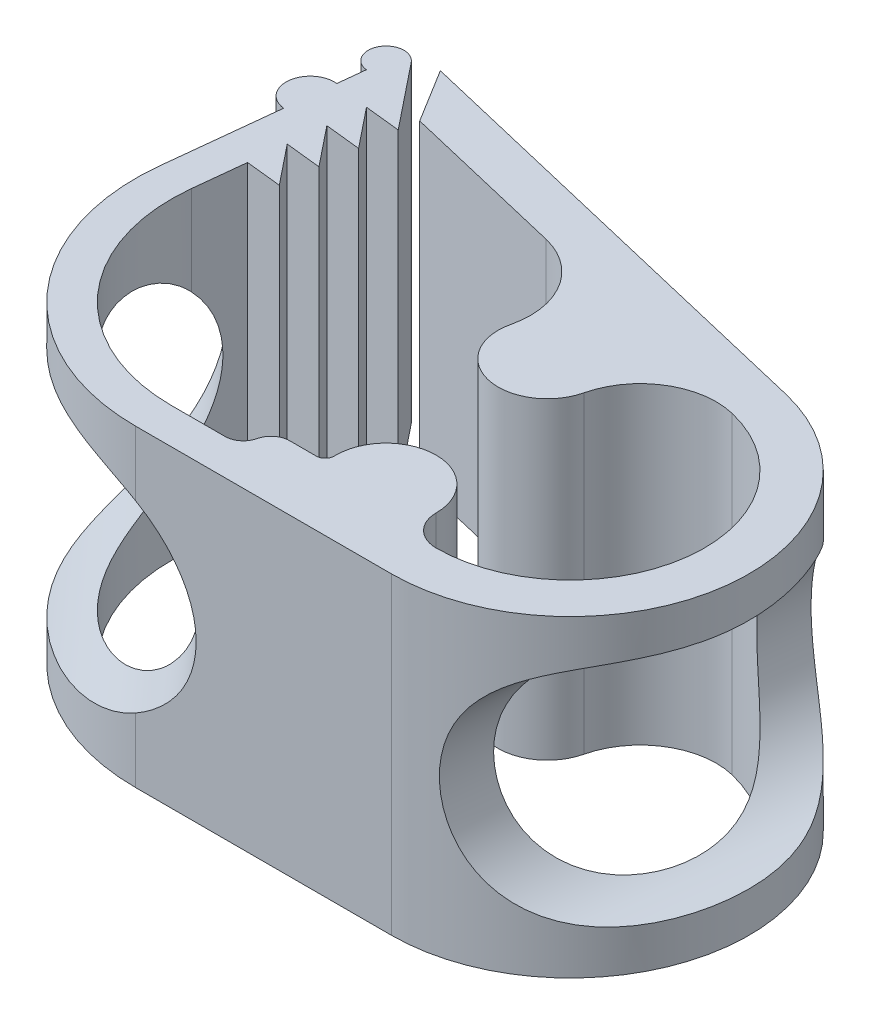
from build123d import *

# Parameters (mm, degrees)
BOSS_EXTRUDE3_DEPTH     = 8.75
CUT_EXTRUDE1_DEPTH      = 30.433335283
CUT_EXTRUDE1_DEPTH_BACK = 30.433335283
SKETCH2_R               = 6.5
CUT_EXTRUDE2_DEPTH      = 30.248560932
CUT_EXTRUDE2_DEPTH_BACK = 30.248560932
SKETCH3_R               = 6.5


with BuildPart() as part:
    # Sketch1 → Boss-Extrude3 (new, symmetric)
    with BuildSketch(Plane(origin=(0, 0, 0), x_dir=(1, 0, 0), z_dir=(0, 1, 0))):
        with BuildLine():
            Line((14.3, -12), (0, -12))
            ThreePointArc((0, -12), (-8.929217577, -8.016799453), (-11.930624431, 1.288487755))
            Line((-11.930624431, 1.288487755), (-11.256544629, 7.530062747))
            ThreePointArc((-11.256544629, 7.530062747), (-12.453785005, 9.017212868), (-10.966634884, 10.214453244))
            Line((-10.966634884, 10.214453244), (-10.805573915, 11.705781297))
            ThreePointArc((-10.805573915, 11.705781297), (-11.574951792, 13.180943013), (-9.917441597, 13.324833112))
            Line((-9.917441597, 13.324833112), (-7.001026651, 9.680635575))
            Line((-7.001026651, 9.680635575), (-8.989464056, 9.895383534))
            Line((-8.989464056, 9.895383534), (-7.217023351, 7.680635575))
            Line((-7.217023351, 7.680635575), (-9.205460756, 7.895383534))
            Line((-9.205460756, 7.895383534), (-7.433020052, 5.680635575))
            Line((-7.433020052, 5.680635575), (-9.421457457, 5.895383534))
            Line((-9.421457457, 5.895383534), (-7.649016752, 3.680635575))
            Line((-7.649016752, 3.680635575), (-9.637454157, 3.895383534))
            Line((-9.637454157, 3.895383534), (-9.942187026, 1.073739796))
            ThreePointArc((-9.942187026, 1.073739796), (-7.441014647, -6.680666211), (0, -10))
            Line((0, -10), (3, -10))
            ThreePointArc((3, -10), (3.640312424, -9.77539053), (4, -9.2))
            ThreePointArc((4, -9.2), (4.359687576, -8.62460947), (5, -8.4))
            Line((5, -8.4), (6.5, -8.4))
            ThreePointArc((6.5, -8.4), (6.853553391, -8.253553391), (7, -7.9))
            Line((7, -7.9), (7, -7.8))
            ThreePointArc((7, -7.8), (9.8, -5), (12.6, -7.8))
            ThreePointArc((12.6, -7.8), (13.097918472, -9.002081528), (14.3, -9.5))
            ThreePointArc((14.3, -9.5), (21.749280739, -2.870756267), (16.029735438, 5.297808939))
            ThreePointArc((16.029735438, 5.297808939), (12.818459255, 4.77966532), (10.914126957, 2.142567288))
            ThreePointArc((10.914126957, 2.142567288), (7.604027352, 0.100940338), (5.562400402, 3.411039943))
            ThreePointArc((5.562400402, 3.411039943), (5.044256782, 6.622316125), (2.407158751, 8.526648423))
            Line((2.407158751, 8.526648423), (-6.836732572, 10.717646644))
            Line((-6.836732572, 10.717646644), (-8.692757073, 13.726828103))
            Line((-8.692757073, 13.726828103), (16.606313917, 7.730411919))
            ThreePointArc((16.606313917, 7.730411919), (24.232374318, -3.161008357), (14.3, -12))
        make_face()
    extrude(amount=BOSS_EXTRUDE3_DEPTH, both=True)

    # Sketch2 → Cut-Extrude1 (cut, two sides: drawn at the far end of the back side and taken through both)
    with BuildSketch(Plane(origin=(-0.037875914, 0, 0.324026741), x_dir=(0.9932374318152281, 0, 0.11610083566060259), z_dir=(-0.11610083566060259, 0, 0.9932374318152281)).offset(-CUT_EXTRUDE1_DEPTH_BACK)):
        with Locations((24.435496946, 0)):
            Circle(SKETCH2_R)
    extrude(amount=CUT_EXTRUDE1_DEPTH + CUT_EXTRUDE1_DEPTH_BACK, mode=Mode.SUBTRACT)

    # Sketch3 → Cut-Extrude2 (cut, two sides: drawn at the far end of the back side and taken through both)
    with BuildSketch(Plane(origin=(0, 0, 0), x_dir=(-0.7441014647171004, 0, 0.6680666210834559), z_dir=(-0.6680666210834559, 0, -0.7441014647171004)).offset(-CUT_EXTRUDE2_DEPTH_BACK)):
        with Locations((12, 0)):
            Circle(SKETCH3_R)
    extrude(amount=CUT_EXTRUDE2_DEPTH + CUT_EXTRUDE2_DEPTH_BACK, mode=Mode.SUBTRACT)


solid = part.part
